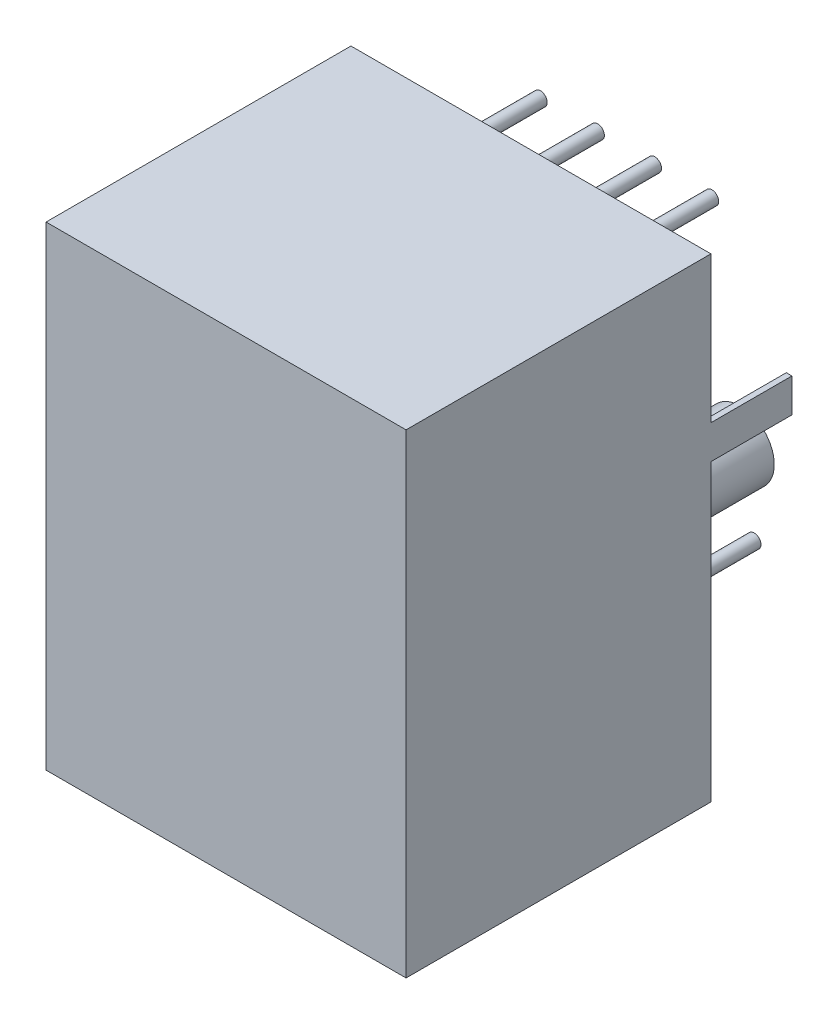
from build123d import *

# Parameters (mm, degrees)
SKETCH_1_W          = 8
SKETCH_1_H          = 21.1
EXTRUDE_1_DEPTH     = 13.55
SKETCH_2_R          = 1.5
SKETCH_2_W          = 0.25
SKETCH_2_H          = 1.5
EXTRUDE_2_DEPTH     = 3.6
CUT_EXTRUDE_1_DEPTH = 12
SKETCH_4_W          = 3.1
SKETCH_4_H          = 1.8
CUT_EXTRUDE_2_DEPTH = 0.01
SKETCH_5_R          = 0.3
EXTRUDE_3_DEPTH     = 3.6


with BuildPart() as part:
    # Эскиз1 → Бобышка-Вытянуть1 (new body)
    with BuildSketch(Plane.XY):
        with Locations((-4, 10.55)):
            Rectangle(SKETCH_1_W, SKETCH_1_H)
    extrude(amount=EXTRUDE_1_DEPTH)

    # Эскиз2 → Бобышка-Вытянуть2 (add)
    with BuildSketch(Plane(origin=(0, 0, 0), x_dir=(-1, 0, 0), z_dir=(0, 0, -1))):
        with Locations((5.715, 10.8)):
            Circle(SKETCH_2_R)
        with Locations((7.875, 13.85)):
            Rectangle(SKETCH_2_W, SKETCH_2_H)
    extrude(amount=EXTRUDE_2_DEPTH)

    # Эскиз3 → Вырез-Вытянуть1 (cut)
    with BuildSketch(Plane.XZ):
        Polygon((0, 1), (-2, 1), (-2, 2.3), (-3.2, 2.3), (-3.2, 4), (-6, 4), (-6, 11.05), (0, 11.05), align=None)
    extrude(amount=-CUT_EXTRUDE_1_DEPTH, mode=Mode.SUBTRACT)

    # Эскиз4 → Вырез-Вытянуть2 (cut)
    with BuildSketch(Plane.XZ):
        with Locations((-5.45, 1.9)):
            Rectangle(SKETCH_4_W, SKETCH_4_H)
    extrude(amount=-CUT_EXTRUDE_2_DEPTH, mode=Mode.SUBTRACT)

    # Зеркальное отражение1: part across plane


with BuildPart() as part_1:
    add(part.part)
    add(part.part.mirror(Plane(origin=(0, 0, 13.55), x_dir=(0, 0, 1), z_dir=(-1, 0, 0))))

    # Эскиз5 → Бобышка-Вытянуть3 (add)
    with BuildSketch(Plane(origin=(0, 0, 0), x_dir=(-1, 0, 0), z_dir=(0, 0, -1))):
        with Locations((-6.325, 7.42)):
            Circle(SKETCH_5_R)
        with Locations((-3.785, 5.9)):
            Circle(SKETCH_5_R)
        with Locations((3.785, 7.42)):
            Circle(SKETCH_5_R)
        with Locations((6.325, 5.9)):
            Circle(SKETCH_5_R)
        with Locations((-4.445, 19.69)):
            Circle(SKETCH_5_R)
        with Locations((-1.905, 19.69)):
            Circle(SKETCH_5_R)
        with Locations((0.635, 19.69)):
            Circle(SKETCH_5_R)
        with Locations((3.175, 19.69)):
            Circle(SKETCH_5_R)
        with Locations((-3.175, 17.15)):
            Circle(SKETCH_5_R)
        with Locations((-0.635, 17.15)):
            Circle(SKETCH_5_R)
        with Locations((1.905, 17.15)):
            Circle(SKETCH_5_R)
        with Locations((4.445, 17.15)):
            Circle(SKETCH_5_R)
    extrude(amount=EXTRUDE_3_DEPTH)


solid = part_1.part
